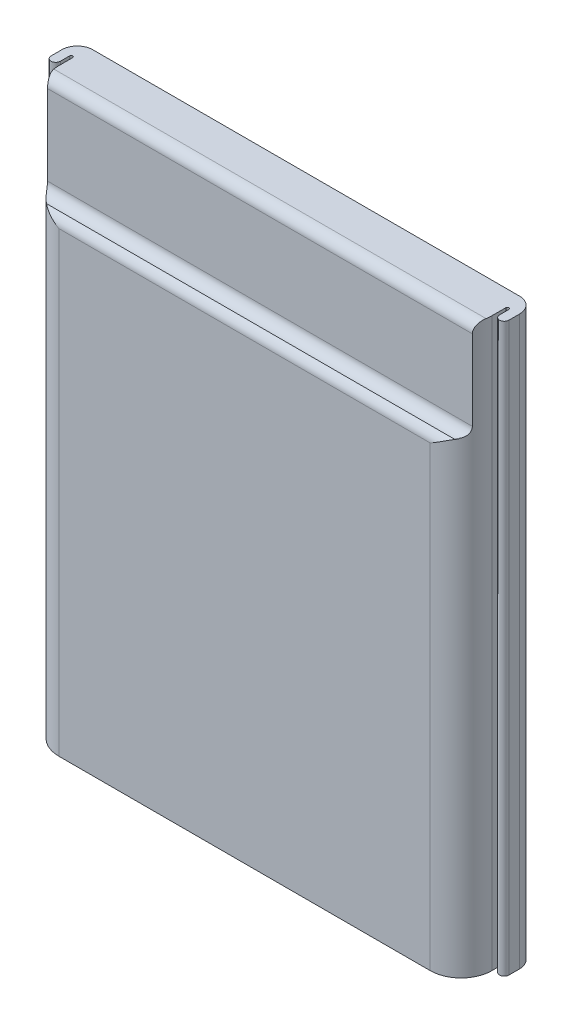
from build123d import *

# Parameters (mm, degrees)
EXTRUDE_1_DEPTH                 = 18.4
CUT_EXTRUDE_1_REACH             = 25.981
CUT_EXTRUDE_1_DIRECTION_2_REACH = 25.981


with BuildPart() as part:
    # Эскиз1 → Бобышка-Вытянуть1 (new, symmetric)
    with BuildSketch(Plane(origin=(0, 0, 0), x_dir=(1, 0, 0), z_dir=(0, 1, 0))):
        with BuildLine():
            Line((-13.85, 0), (13.85, 0))
            ThreePointArc((13.85, 0), (14.557106781, -0.292893219), (14.85, -1))
            Line((14.85, -1), (14.85, -1.7))
            ThreePointArc((14.85, -1.7), (14.55, -2), (14.25, -1.7))
            Line((14.25, -1.7), (14.25, -1.1))
            ThreePointArc((14.25, -1.1), (14.15, -1), (14.05, -1.1))
            Line((14.05, -1.1), (14.05, -2))
            ThreePointArc((14.05, -2), (13.464213562, -3.414213562), (12.05, -4))
            Line((12.05, -4), (-12.05, -4))
            ThreePointArc((-12.05, -4), (-13.464213562, -3.414213562), (-14.05, -2))
            Line((-14.05, -2), (-14.05, -1.1))
            ThreePointArc((-14.05, -1.1), (-14.15, -1), (-14.25, -1.1))
            Line((-14.25, -1.1), (-14.25, -1.7))
            ThreePointArc((-14.25, -1.7), (-14.55, -2), (-14.85, -1.7))
            Line((-14.85, -1.7), (-14.85, -1))
            ThreePointArc((-14.85, -1), (-14.557106781, -0.292893219), (-13.85, 0))
        make_face()
    extrude(amount=EXTRUDE_1_DEPTH, both=True)

    # Эскиз2 → Вырез-Вытянуть1 (cut, up to next)
    with BuildSketch(Plane(origin=(0, 0, 0), x_dir=(0, 0, -1), z_dir=(1, 0, 0)), mode=Mode.PRIVATE) as cut_extrude_1_sk1:
        with BuildLine():
            Line((-3, 17.75), (-3, 12.55))
            ThreePointArc((-3, 12.55), (-3.190380592, 12.090380592), (-3.65, 11.9))
            Line((-3.65, 11.9), (-3.35, 11.9))
            ThreePointArc((-3.35, 11.9), (-3.809619408, 11.709619408), (-4, 11.25))
            Line((-4, 11.25), (-4, 18.4))
            Line((-4, 18.4), (-2.35, 18.4))
            ThreePointArc((-2.35, 18.4), (-2.809619408, 18.209619408), (-3, 17.75))
        make_face()
    cut_extrude_1_tool1 = extrude(cut_extrude_1_sk1.sketch, amount=-CUT_EXTRUDE_1_REACH, mode=Mode.PRIVATE) & part.part
    add(cut_extrude_1_tool1.solids().sort_by_distance((0, 15.188719, 3.500886))[0], mode=Mode.SUBTRACT)

    # Эскиз2 → Вырез-Вытянуть1 direction 2 (cut, up to next)
    with BuildSketch(Plane(origin=(0, 0, 0), x_dir=(0, 0, -1), z_dir=(1, 0, 0)), mode=Mode.PRIVATE) as cut_extrude_1_direction_2_sk1:
        with BuildLine():
            Line((-3, 17.75), (-3, 12.55))
            ThreePointArc((-3, 12.55), (-3.190380592, 12.090380592), (-3.65, 11.9))
            Line((-3.65, 11.9), (-3.35, 11.9))
            ThreePointArc((-3.35, 11.9), (-3.809619408, 11.709619408), (-4, 11.25))
            Line((-4, 11.25), (-4, 18.4))
            Line((-4, 18.4), (-2.35, 18.4))
            ThreePointArc((-2.35, 18.4), (-2.809619408, 18.209619408), (-3, 17.75))
        make_face()
    cut_extrude_1_direction_2_tool1 = extrude(cut_extrude_1_direction_2_sk1.sketch, amount=CUT_EXTRUDE_1_DIRECTION_2_REACH, mode=Mode.PRIVATE) & part.part
    add(cut_extrude_1_direction_2_tool1.solids().sort_by_distance((0, 15.188719, 3.500886))[0], mode=Mode.SUBTRACT)


solid = part.part
